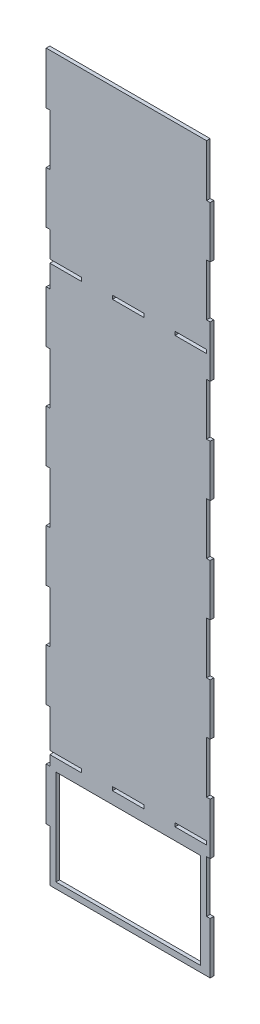
from build123d import *

# Parameters (mm, degrees)
SKETCH1_W           = 120
SKETCH1_H           = 79
SKETCH1_W_2         = 26.12
SKETCH1_H_2         = 3
BOSS_EXTRUDE1_DEPTH = 3


with BuildPart() as part:
    # Sketch1 → Boss-Extrude1 (new body)
    with BuildSketch(Plane.XY):
        Polygon((65, 0), (-67.997818333, 0), (-67.997818333, -43.007142857), (-65, -43.007142857), (-65, -85.714285714), (-67.997818333, -85.714285714), (-67.997818333, -128.721428571), (-65, -128.721428571), (-65, -150), (-38.88, -150), (-38.88, -153), (-65, -153), (-65, -171.428571429), (-67.997818333, -171.428571429), (-67.997818333, -214.435714286), (-65, -214.435714286), (-65, -257.142857143), (-67.997818333, -257.142857143), (-67.997818333, -300.15), (-65, -300.15), (-65, -342.857142857), (-67.997818333, -342.857142857), (-67.997818333, -385.864285714), (-65, -385.864285714), (-65, -428.571428571), (-67.997818333, -428.571428571), (-67.997818333, -471.578571429), (-65, -471.578571429), (-65, -503), (-38.88, -503), (-38.88, -506), (-65, -506), (-65, -514.285714286), (-67.997818333, -514.285714286), (-67.997818333, -557.292857143), (-65, -557.292857143), (-65, -600), (67.997818333, -600), (67.997818333, -557.292857143), (65, -557.292857143), (65, -514.285714286), (67.997818333, -514.285714286), (67.997818333, -471.578571429), (65, -471.578571429), (65, -428.571428571), (67.997818333, -428.571428571), (67.997818333, -385.864285714), (65, -385.864285714), (65, -342.857142857), (67.997818333, -342.857142857), (67.997818333, -300.15), (65, -300.15), (65, -257.142857143), (67.997818333, -257.142857143), (67.997818333, -214.435714286), (65, -214.435714286), (65, -171.428571429), (67.997818333, -171.428571429), (67.997818333, -128.721428571), (65, -128.721428571), (65, -85.714285714), (67.997818333, -85.714285714), (67.997818333, -43.007142857), (65, -43.007142857), align=None)
        with Locations((0, -555.5)):
            Rectangle(SKETCH1_W, SKETCH1_H, mode=Mode.SUBTRACT)
        with Locations((0, -504.5)):
            Rectangle(SKETCH1_W_2, SKETCH1_H_2, mode=Mode.SUBTRACT)
        with Locations((51.94, -504.5)):
            Rectangle(SKETCH1_W_2, SKETCH1_H_2, mode=Mode.SUBTRACT)
        with Locations((0, -151.5)):
            Rectangle(SKETCH1_W_2, SKETCH1_H_2, mode=Mode.SUBTRACT)
        with Locations((51.94, -151.5)):
            Rectangle(SKETCH1_W_2, SKETCH1_H_2, mode=Mode.SUBTRACT)
    extrude(amount=BOSS_EXTRUDE1_DEPTH)


solid = part.part
